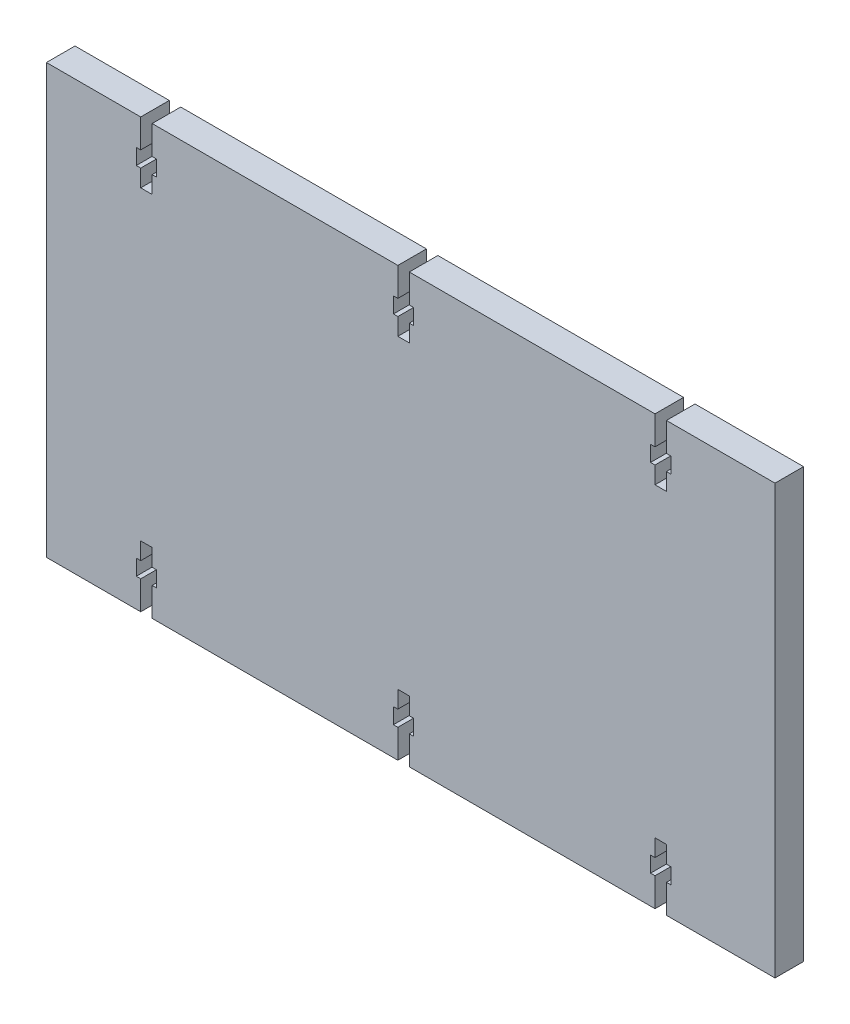
from build123d import *

# Parameters (mm, degrees)
ESQUISSE1_W             = 255
ESQUISSE1_H             = 150
BOSS_EXTRU_1_DEPTH      = 10
ENL_V_MAT_EXTRU_1_DEPTH = 10


with BuildPart() as part:
    # Esquisse1 → Boss.-Extru.1 (new body)
    with BuildSketch(Plane.XY):
        Rectangle(ESQUISSE1_W, ESQUISSE1_H)
    extrude(amount=BOSS_EXTRU_1_DEPTH)

    # Esquisse2 → Enlèv. mat.-Extru.1 (cut)
    with BuildSketch(Plane(origin=(0, 0, 0), x_dir=(-1, 0, 0), z_dir=(0, 0, -1))):
        Polygon((-89.5, 75), (-89.5, 65), (-91.05, 65), (-91.05, 59.5), (-89.5, 59.5), (-89.5, 53.5), (-85.5, 53.5), (-85.5, 59.5), (-83.95, 59.5), (-83.95, 65), (-85.5, 65), (-85.5, 75), align=None)
        Polygon((0.5, 75), (0.5, 65), (-1.05, 65), (-1.05, 59.5), (0.5, 59.5), (0.5, 53.5), (4.5, 53.5), (4.5, 59.5), (6.05, 59.5), (6.05, 65), (4.5, 65), (4.5, 75), align=None)
        Polygon((90.5, 75), (90.5, 65), (88.95, 65), (88.95, 59.5), (90.5, 59.5), (90.5, 53.5), (94.5, 53.5), (94.5, 59.5), (96.05, 59.5), (96.05, 65), (94.5, 65), (94.5, 75), align=None)
        Polygon((94.5, -75), (94.5, -65), (96.05, -65), (96.05, -59.5), (94.5, -59.5), (94.5, -53.5), (90.5, -53.5), (90.5, -59.5), (88.95, -59.5), (88.95, -65), (90.5, -65), (90.5, -75), align=None)
        Polygon((4.5, -75), (4.5, -65), (6.05, -65), (6.05, -59.5), (4.5, -59.5), (4.5, -53.5), (0.5, -53.5), (0.5, -59.5), (-1.05, -59.5), (-1.05, -65), (0.5, -65), (0.5, -75), align=None)
        Polygon((-85.5, -75), (-85.5, -65), (-83.95, -65), (-83.95, -59.5), (-85.5, -59.5), (-85.5, -53.5), (-89.5, -53.5), (-89.5, -59.5), (-91.05, -59.5), (-91.05, -65), (-89.5, -65), (-89.5, -75), align=None)
    extrude(amount=-ENL_V_MAT_EXTRU_1_DEPTH, mode=Mode.SUBTRACT)


solid = part.part
